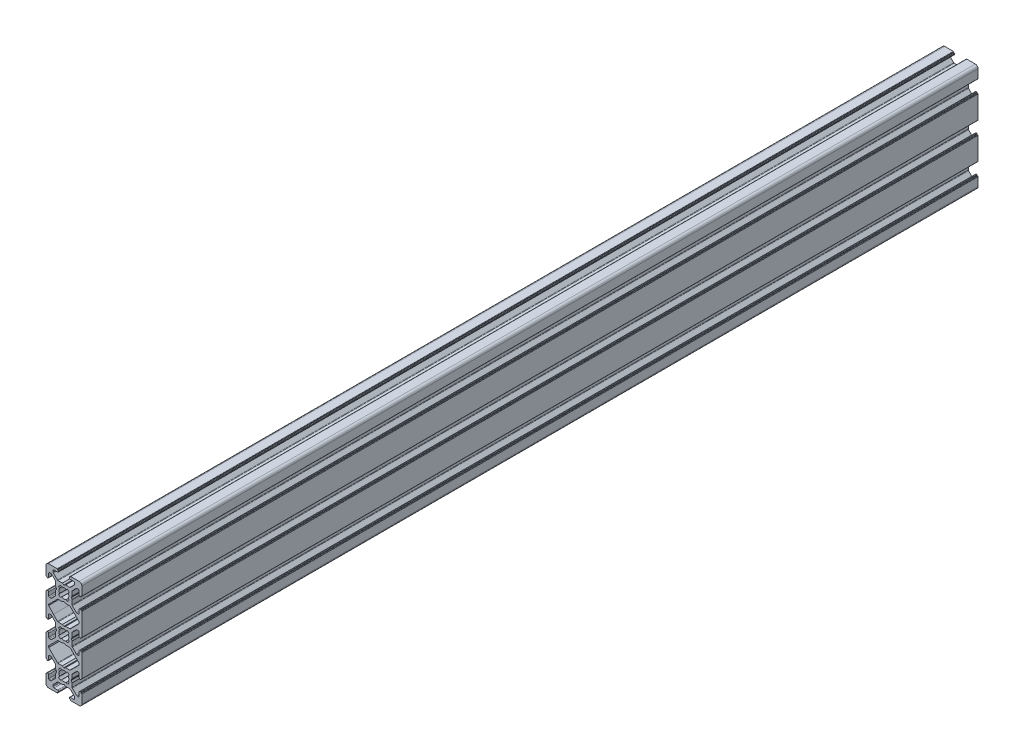
from build123d import *

# Parameters (mm, degrees)
EXTRUDE1_DEPTH = 500


with BuildPart() as part:
    # Sketch2 → Extrude1 (new body)
    with BuildSketch(Plane.XY):
        with BuildLine():
            Line((8.499999987, 16.455782504), (8.499999987, 14.505782744))
            ThreePointArc((8.499999987, 14.505782744), (8.353553378, 14.152229354), (7.999999987, 14.005782744))
            Line((7.999999987, 14.005782744), (7.267767007, 14.005782744))
            ThreePointArc((7.267767007, 14.005782744), (7.076425291, 14.043842978), (6.914213616, 14.152229354))
            Line((6.914213616, 14.152229354), (4.721446323, 16.344996647))
            ThreePointArc((4.721446323, 16.344996647), (4.613059947, 16.507208322), (4.574999713, 16.698550038))
            Line((4.574999713, 16.698550038), (4.574999713, 19.177192543))
            ThreePointArc((4.574999713, 19.177192543), (4.568184878, 19.228956354), (4.548204792, 19.277192547))
            Line((4.548204792, 19.277192547), (4.141986965, 19.980782422))
            ThreePointArc((4.141986965, 19.980782422), (4.115192043, 20.080782422), (4.14198696, 20.180782422))
            Line((4.14198696, 20.180782422), (4.548204796, 20.884372394))
            ThreePointArc((4.548204796, 20.884372394), (4.568184879, 20.932608583), (4.574999713, 20.98437239))
            Line((4.574999713, 20.98437239), (4.574999713, 23.313015505))
            ThreePointArc((4.574999713, 23.313015505), (4.613059942, 23.50435721), (4.721446305, 23.666568878))
            Line((4.721446305, 23.666568878), (6.914213331, 25.859336117))
            ThreePointArc((6.914213331, 25.859336117), (7.076425073, 25.967722531), (7.267766873, 26.005782744))
            Line((7.267766873, 26.005782744), (7.999999853, 26.005782744))
            ThreePointArc((7.999999853, 26.005782744), (8.353553338, 25.859336095), (8.499999987, 25.50578261))
            Line((8.499999987, 25.50578261), (8.499999987, 23.455782504))
            ThreePointArc((8.499999987, 23.455782504), (8.646446596, 23.102229113), (8.999999987, 22.955782504))
            Line((8.999999987, 22.955782504), (9.29999992, 22.955782504))
            ThreePointArc((9.29999992, 22.955782504), (9.441421276, 23.014361147), (9.49999992, 23.155782504))
            Line((9.49999992, 23.155782504), (9.49999992, 23.255782504))
            ThreePointArc((9.49999992, 23.255782504), (9.558578564, 23.39720386), (9.69999992, 23.455782504))
            Line((9.69999992, 23.455782504), (9.79999992, 23.455782504))
            ThreePointArc((9.79999992, 23.455782504), (9.941421276, 23.514361147), (9.99999992, 23.655782504))
            Line((9.99999992, 23.655782504), (9.99999992, 36.255782504))
            ThreePointArc((9.99999992, 36.255782504), (9.941421276, 36.39720386), (9.79999992, 36.455782504))
            Line((9.79999992, 36.455782504), (9.69999992, 36.455782504))
            ThreePointArc((9.69999992, 36.455782504), (9.558578564, 36.514361147), (9.49999992, 36.655782504))
            Line((9.49999992, 36.655782504), (9.49999992, 36.755782504))
            ThreePointArc((9.49999992, 36.755782504), (9.441421276, 36.89720386), (9.29999992, 36.955782504))
            Line((9.29999992, 36.955782504), (8.999999987, 36.955782504))
            ThreePointArc((8.999999987, 36.955782504), (8.646446596, 36.809335894), (8.499999987, 36.455782504))
            Line((8.499999987, 36.455782504), (8.499999987, 34.505782744))
            ThreePointArc((8.499999987, 34.505782744), (8.353553378, 34.152229354), (7.999999987, 34.005782744))
            Line((7.999999987, 34.005782744), (7.267767007, 34.005782744))
            ThreePointArc((7.267767007, 34.005782744), (7.076425291, 34.043842978), (6.914213616, 34.152229354))
            Line((6.914213616, 34.152229354), (4.721446323, 36.344996647))
            ThreePointArc((4.721446323, 36.344996647), (4.613059947, 36.507208322), (4.574999713, 36.698550038))
            Line((4.574999713, 36.698550038), (4.574999713, 39.177192543))
            ThreePointArc((4.574999713, 39.177192543), (4.568184878, 39.228956354), (4.548204792, 39.277192547))
            Line((4.548204792, 39.277192547), (4.141986965, 39.980782422))
            ThreePointArc((4.141986965, 39.980782422), (4.115192043, 40.080782422), (4.14198696, 40.180782422))
            Line((4.14198696, 40.180782422), (4.548204796, 40.884372394))
            ThreePointArc((4.548204796, 40.884372394), (4.568184879, 40.932608583), (4.574999713, 40.98437239))
            Line((4.574999713, 40.98437239), (4.574999713, 43.313015505))
            ThreePointArc((4.574999713, 43.313015505), (4.613059942, 43.50435721), (4.721446305, 43.666568878))
            Line((4.721446305, 43.666568878), (6.914213331, 45.859336117))
            ThreePointArc((6.914213331, 45.859336117), (7.076425073, 45.967722531), (7.267766873, 46.005782744))
            Line((7.267766873, 46.005782744), (7.999999853, 46.005782744))
            ThreePointArc((7.999999853, 46.005782744), (8.35355333, 45.859336182), (8.499999987, 45.505782744))
            Line((8.499999987, 45.505782744), (8.499999987, 43.455782504))
            ThreePointArc((8.499999987, 43.455782504), (8.646446596, 43.102229113), (8.999999987, 42.955782504))
            Line((8.999999987, 42.955782504), (9.29999992, 42.955782504))
            ThreePointArc((9.29999992, 42.955782504), (9.441421276, 43.014361147), (9.49999992, 43.155782504))
            Line((9.49999992, 43.155782504), (9.49999992, 43.255782504))
            ThreePointArc((9.49999992, 43.255782504), (9.558578564, 43.39720386), (9.69999992, 43.455782504))
            Line((9.69999992, 43.455782504), (9.79999992, 43.455782504))
            ThreePointArc((9.79999992, 43.455782504), (9.941421276, 43.514361147), (9.99999992, 43.655782504))
            Line((9.99999992, 43.655782504), (9.99999992, 48.49999967))
            ThreePointArc((9.99999992, 48.49999967), (9.560660092, 49.560659842), (8.49999992, 49.99999967))
            Line((8.49999992, 49.99999967), (3.74999992, 49.99999967))
            ThreePointArc((3.74999992, 49.99999967), (3.608578564, 49.941421026), (3.54999992, 49.79999967))
            Line((3.54999992, 49.79999967), (3.54999992, 49.69999967))
            ThreePointArc((3.54999992, 49.69999967), (3.491421276, 49.558578314), (3.34999992, 49.49999967))
            Line((3.34999992, 49.49999967), (3.2, 49.49999967))
            ThreePointArc((3.2, 49.49999967), (3.058578644, 49.441421026), (3, 49.29999967))
            Line((3, 49.29999967), (3, 48.99999967))
            ThreePointArc((3, 48.99999967), (3.146446609, 48.646446279), (3.5, 48.49999967))
            Line((3.5, 48.49999967), (5.5, 48.49999967))
            ThreePointArc((5.5, 48.49999967), (5.853553391, 48.353553061), (6, 47.99999967))
            Line((6, 47.99999967), (6, 47.267766556))
            ThreePointArc((6, 47.267766556), (5.961939766, 47.07642484), (5.853553391, 46.914213165))
            Line((5.853553391, 46.914213165), (3.585786528, 44.646446303))
            ThreePointArc((3.585786528, 44.646446303), (3.423574854, 44.538059927), (3.232233137, 44.499999693))
            Line((3.232233137, 44.499999693), (0.953589731, 44.499999693))
            ThreePointArc((0.953589731, 44.499999693), (0.901825919, 44.493184858), (0.853589726, 44.473204772))
            Line((0.853589726, 44.473204772), (0.059202761, 44.014565218))
            ThreePointArc((0.059202761, 44.014565218), (0, 43.998701885), (-0.059202761, 44.014565218))
            Line((-0.059202761, 44.014565218), (-0.853589726, 44.473204772))
            ThreePointArc((-0.853589726, 44.473204772), (-0.901825919, 44.493184858), (-0.953589731, 44.499999693))
            Line((-0.953589731, 44.499999693), (-3.232233137, 44.499999693))
            ThreePointArc((-3.232233137, 44.499999693), (-3.423574854, 44.538059927), (-3.585786528, 44.646446303))
            Line((-3.585786528, 44.646446303), (-5.853553391, 46.914213165))
            ThreePointArc((-5.853553391, 46.914213165), (-5.961939766, 47.07642484), (-6, 47.267766556))
            Line((-6, 47.267766556), (-6, 47.99999967))
            ThreePointArc((-6, 47.99999967), (-5.853553391, 48.353553061), (-5.5, 48.49999967))
            Line((-5.5, 48.49999967), (-3.5, 48.49999967))
            ThreePointArc((-3.5, 48.49999967), (-3.146446609, 48.646446279), (-3, 48.99999967))
            Line((-3, 48.99999967), (-3, 49.29999967))
            ThreePointArc((-3, 49.29999967), (-3.058578644, 49.441421026), (-3.2, 49.49999967))
            Line((-3.2, 49.49999967), (-3.34999992, 49.49999967))
            ThreePointArc((-3.34999992, 49.49999967), (-3.491421276, 49.558578314), (-3.54999992, 49.69999967))
            Line((-3.54999992, 49.69999967), (-3.54999992, 49.79999967))
            ThreePointArc((-3.54999992, 49.79999967), (-3.608578564, 49.941421026), (-3.74999992, 49.99999967))
            Line((-3.74999992, 49.99999967), (-8.49999992, 49.99999967))
            ThreePointArc((-8.49999992, 49.99999967), (-9.560660092, 49.560659842), (-9.99999992, 48.49999967))
            Line((-9.99999992, 48.49999967), (-9.99999992, 43.655782504))
            ThreePointArc((-9.99999992, 43.655782504), (-9.941421276, 43.514361147), (-9.79999992, 43.455782504))
            Line((-9.79999992, 43.455782504), (-9.69999992, 43.455782504))
            ThreePointArc((-9.69999992, 43.455782504), (-9.558578564, 43.39720386), (-9.49999992, 43.255782504))
            Line((-9.49999992, 43.255782504), (-9.49999992, 43.155782504))
            ThreePointArc((-9.49999992, 43.155782504), (-9.441421276, 43.014361147), (-9.29999992, 42.955782504))
            Line((-9.29999992, 42.955782504), (-8.999999987, 42.955782504))
            ThreePointArc((-8.999999987, 42.955782504), (-8.646446596, 43.102229113), (-8.499999987, 43.455782504))
            Line((-8.499999987, 43.455782504), (-8.499999987, 45.50578261))
            ThreePointArc((-8.499999987, 45.50578261), (-8.353553338, 45.859336095), (-7.999999853, 46.005782744))
            Line((-7.999999853, 46.005782744), (-7.267766739, 46.005782744))
            ThreePointArc((-7.267766739, 46.005782744), (-7.076425012, 45.967722506), (-6.914213331, 45.859336117))
            Line((-6.914213331, 45.859336117), (-4.721446305, 43.666568878))
            ThreePointArc((-4.721446305, 43.666568878), (-4.613059942, 43.50435721), (-4.574999713, 43.313015505))
            Line((-4.574999713, 43.313015505), (-4.574999713, 40.98437239))
            ThreePointArc((-4.574999713, 40.98437239), (-4.568184879, 40.932608583), (-4.548204796, 40.884372394))
            Line((-4.548204796, 40.884372394), (-4.14198696, 40.180782422))
            ThreePointArc((-4.14198696, 40.180782422), (-4.115192043, 40.080782422), (-4.141986965, 39.980782422))
            Line((-4.141986965, 39.980782422), (-4.548204792, 39.277192547))
            ThreePointArc((-4.548204792, 39.277192547), (-4.568184878, 39.228956354), (-4.574999713, 39.177192543))
            Line((-4.574999713, 39.177192543), (-4.574999713, 36.698550038))
            ThreePointArc((-4.574999713, 36.698550038), (-4.613059947, 36.507208322), (-4.721446323, 36.344996647))
            Line((-4.721446323, 36.344996647), (-6.914213616, 34.152229354))
            ThreePointArc((-6.914213616, 34.152229354), (-7.076425291, 34.043842978), (-7.267767007, 34.005782744))
            Line((-7.267767007, 34.005782744), (-7.999999987, 34.005782744))
            ThreePointArc((-7.999999987, 34.005782744), (-8.353553378, 34.152229354), (-8.499999987, 34.505782744))
            Line((-8.499999987, 34.505782744), (-8.499999987, 36.455782504))
            ThreePointArc((-8.499999987, 36.455782504), (-8.646446596, 36.809335894), (-8.999999987, 36.955782504))
            Line((-8.999999987, 36.955782504), (-9.29999992, 36.955782504))
            ThreePointArc((-9.29999992, 36.955782504), (-9.441421276, 36.89720386), (-9.49999992, 36.755782504))
            Line((-9.49999992, 36.755782504), (-9.49999992, 36.655782504))
            ThreePointArc((-9.49999992, 36.655782504), (-9.558578564, 36.514361147), (-9.69999992, 36.455782504))
            Line((-9.69999992, 36.455782504), (-9.79999992, 36.455782504))
            ThreePointArc((-9.79999992, 36.455782504), (-9.941421276, 36.39720386), (-9.99999992, 36.255782504))
            Line((-9.99999992, 36.255782504), (-9.99999992, 23.655782504))
            ThreePointArc((-9.99999992, 23.655782504), (-9.941421276, 23.514361147), (-9.79999992, 23.455782504))
            Line((-9.79999992, 23.455782504), (-9.69999992, 23.455782504))
            ThreePointArc((-9.69999992, 23.455782504), (-9.558578564, 23.39720386), (-9.49999992, 23.255782504))
            Line((-9.49999992, 23.255782504), (-9.49999992, 23.155782504))
            ThreePointArc((-9.49999992, 23.155782504), (-9.441421276, 23.014361147), (-9.29999992, 22.955782504))
            Line((-9.29999992, 22.955782504), (-8.999999987, 22.955782504))
            ThreePointArc((-8.999999987, 22.955782504), (-8.646446596, 23.102229113), (-8.499999987, 23.455782504))
            Line((-8.499999987, 23.455782504), (-8.499999987, 25.50578261))
            ThreePointArc((-8.499999987, 25.50578261), (-8.353553338, 25.859336095), (-7.999999853, 26.005782744))
            Line((-7.999999853, 26.005782744), (-7.267766873, 26.005782744))
            ThreePointArc((-7.267766873, 26.005782744), (-7.076425073, 25.967722531), (-6.914213331, 25.859336117))
            Line((-6.914213331, 25.859336117), (-4.721446305, 23.666568878))
            ThreePointArc((-4.721446305, 23.666568878), (-4.613059942, 23.50435721), (-4.574999713, 23.313015505))
            Line((-4.574999713, 23.313015505), (-4.574999713, 20.98437239))
            ThreePointArc((-4.574999713, 20.98437239), (-4.568184879, 20.932608583), (-4.548204796, 20.884372394))
            Line((-4.548204796, 20.884372394), (-4.14198696, 20.180782422))
            ThreePointArc((-4.14198696, 20.180782422), (-4.115192043, 20.080782422), (-4.141986965, 19.980782422))
            Line((-4.141986965, 19.980782422), (-4.548204792, 19.277192547))
            ThreePointArc((-4.548204792, 19.277192547), (-4.568184878, 19.228956354), (-4.574999713, 19.177192543))
            Line((-4.574999713, 19.177192543), (-4.574999713, 16.698550038))
            ThreePointArc((-4.574999713, 16.698550038), (-4.613059947, 16.507208322), (-4.721446323, 16.344996647))
            Line((-4.721446323, 16.344996647), (-6.914213616, 14.152229354))
            ThreePointArc((-6.914213616, 14.152229354), (-7.076425291, 14.043842978), (-7.267767007, 14.005782744))
            Line((-7.267767007, 14.005782744), (-7.999999987, 14.005782744))
            ThreePointArc((-7.999999987, 14.005782744), (-8.353553378, 14.152229354), (-8.499999987, 14.505782744))
            Line((-8.499999987, 14.505782744), (-8.499999987, 16.455782504))
            ThreePointArc((-8.499999987, 16.455782504), (-8.646446596, 16.809335894), (-8.999999987, 16.955782504))
            Line((-8.999999987, 16.955782504), (-9.29999992, 16.955782504))
            ThreePointArc((-9.29999992, 16.955782504), (-9.441421276, 16.89720386), (-9.49999992, 16.755782504))
            Line((-9.49999992, 16.755782504), (-9.49999992, 16.655782504))
            ThreePointArc((-9.49999992, 16.655782504), (-9.558578564, 16.514361147), (-9.69999992, 16.455782504))
            Line((-9.69999992, 16.455782504), (-9.79999992, 16.455782504))
            ThreePointArc((-9.79999992, 16.455782504), (-9.941421276, 16.39720386), (-9.99999992, 16.255782504))
            Line((-9.99999992, 16.255782504), (-9.99999992, 3.75))
            ThreePointArc((-9.99999992, 3.75), (-9.941421276, 3.608578644), (-9.79999992, 3.55))
            Line((-9.79999992, 3.55), (-9.69999992, 3.55))
            ThreePointArc((-9.69999992, 3.55), (-9.558578564, 3.491421356), (-9.49999992, 3.35))
            Line((-9.49999992, 3.35), (-9.49999992, 3.2))
            ThreePointArc((-9.49999992, 3.2), (-9.441421276, 3.058578644), (-9.29999992, 3))
            Line((-9.29999992, 3), (-8.99999992, 3))
            ThreePointArc((-8.99999992, 3), (-8.646446529, 3.146446609), (-8.49999992, 3.5))
            Line((-8.49999992, 3.5), (-8.49999992, 5.5))
            ThreePointArc((-8.49999992, 5.5), (-8.353553311, 5.853553391), (-7.99999992, 6))
            Line((-7.99999992, 6), (-7.467766346, 6))
            ThreePointArc((-7.467766346, 6), (-7.27642463, 5.961939766), (-7.114212955, 5.853553391))
            Line((-7.114212955, 5.853553391), (-4.721446323, 3.460786758))
            ThreePointArc((-4.721446323, 3.460786758), (-4.613059947, 3.298575084), (-4.574999713, 3.107233367))
            Line((-4.574999713, 3.107233367), (-4.574999713, 1.083493192))
            ThreePointArc((-4.574999713, 1.083493192), (-4.568184878, 1.031729383), (-4.548204794, 0.983493192))
            Line((-4.548204794, 0.983493192), (-4.038119761, 0.1))
            ThreePointArc((-4.038119761, 0.1), (-4.011324842, 0), (-4.038119761, -0.1))
            Line((-4.038119761, -0.1), (-4.548204794, -0.983493192))
            ThreePointArc((-4.548204794, -0.983493192), (-4.568184878, -1.031729383), (-4.574999713, -1.083493192))
            Line((-4.574999713, -1.083493192), (-4.574999713, -3.107233367))
            ThreePointArc((-4.574999713, -3.107233367), (-4.613059947, -3.298575084), (-4.721446323, -3.460786758))
            Line((-4.721446323, -3.460786758), (-7.114212955, -5.853553391))
            ThreePointArc((-7.114212955, -5.853553391), (-7.27642463, -5.961939766), (-7.467766346, -6))
            Line((-7.467766346, -6), (-7.99999992, -6))
            ThreePointArc((-7.99999992, -6), (-8.353553311, -5.853553391), (-8.49999992, -5.5))
            Line((-8.49999992, -5.5), (-8.49999992, -3.5))
            ThreePointArc((-8.49999992, -3.5), (-8.646446529, -3.146446609), (-8.99999992, -3))
            Line((-8.99999992, -3), (-9.29999992, -3))
            ThreePointArc((-9.29999992, -3), (-9.441421276, -3.058578644), (-9.49999992, -3.2))
            Line((-9.49999992, -3.2), (-9.49999992, -3.35))
            ThreePointArc((-9.49999992, -3.35), (-9.558578564, -3.491421356), (-9.69999992, -3.55))
            Line((-9.69999992, -3.55), (-9.79999992, -3.55))
            ThreePointArc((-9.79999992, -3.55), (-9.941421276, -3.608578644), (-9.99999992, -3.75))
            Line((-9.99999992, -3.75), (-9.99999992, -8.5))
            ThreePointArc((-9.99999992, -8.5), (-9.560660092, -9.560660172), (-8.49999992, -10))
            Line((-8.49999992, -10), (-3.74999992, -10))
            ThreePointArc((-3.74999992, -10), (-3.608578564, -9.941421356), (-3.54999992, -9.8))
            Line((-3.54999992, -9.8), (-3.54999992, -9.7))
            ThreePointArc((-3.54999992, -9.7), (-3.491421276, -9.558578644), (-3.34999992, -9.5))
            Line((-3.34999992, -9.5), (-3.2, -9.5))
            ThreePointArc((-3.2, -9.5), (-3.058578644, -9.441421356), (-3, -9.3))
            Line((-3, -9.3), (-3, -9))
            ThreePointArc((-3, -9), (-3.146446609, -8.646446609), (-3.5, -8.5))
            Line((-3.5, -8.5), (-5.5, -8.5))
            ThreePointArc((-5.5, -8.5), (-5.853553391, -8.353553391), (-6, -8))
            Line((-6, -8), (-6, -7.267766929))
            ThreePointArc((-6, -7.267766929), (-5.961939766, -7.076425212), (-5.853553391, -6.914213538))
            Line((-5.853553391, -6.914213538), (-3.585786494, -4.646446642))
            ThreePointArc((-3.585786494, -4.646446642), (-3.42357482, -4.538060266), (-3.232233104, -4.500000032))
            Line((-3.232233104, -4.500000032), (-0.953589838, -4.500000032))
            ThreePointArc((-0.953589838, -4.500000032), (-0.901826029, -4.493185198), (-0.853589838, -4.473205113))
            Line((-0.853589838, -4.473205113), (-0.1, -4.038119817))
            ThreePointArc((-0.1, -4.038119817), (0, -4.011324898), (0.1, -4.038119817))
            Line((0.1, -4.038119817), (0.853589838, -4.473205113))
            ThreePointArc((0.853589838, -4.473205113), (0.901826029, -4.493185198), (0.953589838, -4.500000032))
            Line((0.953589838, -4.500000032), (3.232233104, -4.500000032))
            ThreePointArc((3.232233104, -4.500000032), (3.42357482, -4.538060266), (3.585786494, -4.646446642))
            Line((3.585786494, -4.646446642), (5.853553391, -6.914213538))
            ThreePointArc((5.853553391, -6.914213538), (5.961939766, -7.076425212), (6, -7.267766929))
            Line((6, -7.267766929), (6, -8))
            ThreePointArc((6, -8), (5.853553391, -8.353553391), (5.5, -8.5))
            Line((5.5, -8.5), (3.5, -8.5))
            ThreePointArc((3.5, -8.5), (3.146446609, -8.646446609), (3, -9))
            Line((3, -9), (3, -9.3))
            ThreePointArc((3, -9.3), (3.058578644, -9.441421356), (3.2, -9.5))
            Line((3.2, -9.5), (3.34999992, -9.5))
            ThreePointArc((3.34999992, -9.5), (3.491421276, -9.558578644), (3.54999992, -9.7))
            Line((3.54999992, -9.7), (3.54999992, -9.8))
            ThreePointArc((3.54999992, -9.8), (3.608578564, -9.941421356), (3.74999992, -10))
            Line((3.74999992, -10), (8.49999992, -10))
            ThreePointArc((8.49999992, -10), (9.560660092, -9.560660172), (9.99999992, -8.5))
            Line((9.99999992, -8.5), (9.99999992, -3.7))
            ThreePointArc((9.99999992, -3.7), (9.941421276, -3.558578644), (9.79999992, -3.5))
            Line((9.79999992, -3.5), (9.69999992, -3.5))
            ThreePointArc((9.69999992, -3.5), (9.558578564, -3.441421356), (9.49999992, -3.3))
            Line((9.49999992, -3.3), (9.49999992, -3.2))
            ThreePointArc((9.49999992, -3.2), (9.441421276, -3.058578644), (9.29999992, -3))
            Line((9.29999992, -3), (8.99999992, -3))
            ThreePointArc((8.99999992, -3), (8.646446529, -3.146446609), (8.49999992, -3.5))
            Line((8.49999992, -3.5), (8.49999992, -5.499999866))
            ThreePointArc((8.49999992, -5.499999866), (8.353553271, -5.853553351), (7.999999786, -6))
            Line((7.999999786, -6), (7.467766346, -6))
            ThreePointArc((7.467766346, -6), (7.27642463, -5.961939766), (7.114212955, -5.853553391))
            Line((7.114212955, -5.853553391), (4.721446323, -3.460786758))
            ThreePointArc((4.721446323, -3.460786758), (4.613059947, -3.298575084), (4.574999713, -3.107233367))
            Line((4.574999713, -3.107233367), (4.574999713, -1.083493446))
            ThreePointArc((4.574999713, -1.083493446), (4.568184878, -1.031729637), (4.548204794, -0.983493446))
            Line((4.548204794, -0.983493446), (4.038119615, -0.1))
            ThreePointArc((4.038119615, -0.1), (4.011324696, 0), (4.038119615, 0.1))
            Line((4.038119615, 0.1), (4.548204794, 0.983493446))
            ThreePointArc((4.548204794, 0.983493446), (4.568184878, 1.031729637), (4.574999713, 1.083493446))
            Line((4.574999713, 1.083493446), (4.574999713, 3.107233367))
            ThreePointArc((4.574999713, 3.107233367), (4.613059947, 3.298575084), (4.721446323, 3.460786758))
            Line((4.721446323, 3.460786758), (7.114212955, 5.853553391))
            ThreePointArc((7.114212955, 5.853553391), (7.27642463, 5.961939766), (7.467766346, 6))
            Line((7.467766346, 6), (7.999999786, 6))
            ThreePointArc((7.999999786, 6), (8.353553177, 5.853553391), (8.499999786, 5.5))
            Line((8.499999786, 5.5), (8.499999786, 3.5))
            ThreePointArc((8.499999786, 3.5), (8.646446395, 3.146446609), (8.999999786, 3))
            Line((8.999999786, 3), (9.299999961, 3))
            ThreePointArc((9.299999961, 3), (9.441421317, 3.058578644), (9.499999961, 3.2))
            Line((9.499999961, 3.2), (9.499999961, 3.3))
            ThreePointArc((9.499999961, 3.3), (9.558578605, 3.441421356), (9.699999961, 3.5))
            Line((9.699999961, 3.5), (9.79999992, 3.5))
            ThreePointArc((9.79999992, 3.5), (9.941421276, 3.558578644), (9.99999992, 3.7))
            Line((9.99999992, 3.7), (9.99999992, 16.255782504))
            ThreePointArc((9.99999992, 16.255782504), (9.941421276, 16.39720386), (9.79999992, 16.455782504))
            Line((9.79999992, 16.455782504), (9.69999992, 16.455782504))
            ThreePointArc((9.69999992, 16.455782504), (9.558578564, 16.514361147), (9.49999992, 16.655782504))
            Line((9.49999992, 16.655782504), (9.49999992, 16.755782504))
            ThreePointArc((9.49999992, 16.755782504), (9.441421276, 16.89720386), (9.29999992, 16.955782504))
            Line((9.29999992, 16.955782504), (8.999999987, 16.955782504))
            ThreePointArc((8.999999987, 16.955782504), (8.646446596, 16.809335894), (8.499999987, 16.455782504))
        make_face()
        with BuildLine():
            Line((-8.499999987, 30.445123452), (-8.499999987, 29.884028549))
            Line((-8.499999987, 29.884028549), (-5.853553391, 26.914213165))
            Line((-5.853553391, 26.914213165), (-3.585786528, 24.646446303))
            ThreePointArc((-3.585786528, 24.646446303), (-3.423574854, 24.538059927), (-3.232233137, 24.499999693))
            Line((-3.232233137, 24.499999693), (-0.953589731, 24.499999693))
            ThreePointArc((-0.953589731, 24.499999693), (-0.901825919, 24.493184858), (-0.853589726, 24.473204772))
            Line((-0.853589726, 24.473204772), (-0.059202761, 24.014565218))
            ThreePointArc((-0.059202761, 24.014565218), (0, 23.998701885), (0.059202761, 24.014565218))
            Line((0.059202761, 24.014565218), (0.853589726, 24.473204772))
            ThreePointArc((0.853589726, 24.473204772), (0.901825919, 24.493184858), (0.953589731, 24.499999693))
            Line((0.953589731, 24.499999693), (3.232233137, 24.499999693))
            ThreePointArc((3.232233137, 24.499999693), (3.423574854, 24.538059927), (3.585786528, 24.646446303))
            Line((3.585786528, 24.646446303), (5.853553391, 26.914213165))
            Line((5.853553391, 26.914213165), (8.499999987, 29.560659762))
            Line((8.499999987, 29.560659762), (8.499999987, 30.445123452))
            Line((8.499999987, 30.445123452), (3.585786708, 35.359336253))
            ThreePointArc((3.585786708, 35.359336253), (3.423575039, 35.467722616), (3.232233334, 35.505782845))
            Line((3.232233334, 35.505782845), (0.953589908, 35.505782845))
            ThreePointArc((0.953589908, 35.505782845), (0.901826101, 35.512597679), (0.853589912, 35.532577762))
            Line((0.853589912, 35.532577762), (0.100000013, 35.967663068))
            ThreePointArc((0.100000013, 35.967663068), (0, 35.99445799), (-0.100000013, 35.967663068))
            Line((-0.100000013, 35.967663068), (-0.853589912, 35.532577762))
            ThreePointArc((-0.853589912, 35.532577762), (-0.901826101, 35.512597679), (-0.953589908, 35.505782845))
            Line((-0.953589908, 35.505782845), (-3.232233334, 35.505782845))
            ThreePointArc((-3.232233334, 35.505782845), (-3.423575039, 35.467722616), (-3.585786708, 35.359336253))
            Line((-3.585786708, 35.359336253), (-8.499999987, 30.445123452))
        make_face(mode=Mode.SUBTRACT)
        with BuildLine():
            Line((-3.585786481, 4.646446666), (-8.499999987, 9.560660172))
            Line((-8.499999987, 9.560660172), (-8.499999987, 10.445123452))
            Line((-8.499999987, 10.445123452), (-3.585786708, 15.359336253))
            ThreePointArc((-3.585786708, 15.359336253), (-3.423575039, 15.467722616), (-3.232233334, 15.505782845))
            Line((-3.232233334, 15.505782845), (-0.953589908, 15.505782845))
            ThreePointArc((-0.953589908, 15.505782845), (-0.901826101, 15.512597679), (-0.853589912, 15.532577762))
            Line((-0.853589912, 15.532577762), (-0.100000013, 15.967663068))
            ThreePointArc((-0.100000013, 15.967663068), (0, 15.99445799), (0.100000013, 15.967663068))
            Line((0.100000013, 15.967663068), (0.853589912, 15.532577762))
            ThreePointArc((0.853589912, 15.532577762), (0.901826101, 15.512597679), (0.953589908, 15.505782845))
            Line((0.953589908, 15.505782845), (3.232233334, 15.505782845))
            ThreePointArc((3.232233334, 15.505782845), (3.423575039, 15.467722616), (3.585786708, 15.359336253))
            Line((3.585786708, 15.359336253), (8.499999987, 10.445123452))
            Line((8.499999987, 10.445123452), (8.499999987, 9.560660172))
            Line((8.499999987, 9.560660172), (3.585786481, 4.646446666))
            ThreePointArc((3.585786481, 4.646446666), (3.423574807, 4.538060291), (3.232233091, 4.500000057))
            Line((3.232233091, 4.500000057), (0.953589684, 4.500000057))
            ThreePointArc((0.953589684, 4.500000057), (0.901825873, 4.493185221), (0.85358968, 4.473205135))
            Line((0.85358968, 4.473205135), (0.100000004, 4.038119909))
            ThreePointArc((0.100000004, 4.038119909), (8.8e-08, 4.011324987), (-0.099999852, 4.038119821))
            Line((-0.099999852, 4.038119821), (-0.85358968, 4.473205135))
            ThreePointArc((-0.85358968, 4.473205135), (-0.901825873, 4.493185221), (-0.953589684, 4.500000057))
            Line((-0.953589684, 4.500000057), (-3.232233091, 4.500000057))
            ThreePointArc((-3.232233091, 4.500000057), (-3.423574807, 4.538060291), (-3.585786481, 4.646446666))
        make_face(mode=Mode.SUBTRACT)
        with BuildLine():
            Line((1.258185436, 2.445295362), (1.909931107, 2.99217486))
            ThreePointArc((1.909931107, 2.99217486), (2.508410608, 2.511737138), (2.989641056, 1.913894874))
            Line((2.989641056, 1.913894874), (2.445295423, 1.258185317))
            ThreePointArc((2.445295423, 1.258185317), (2.75, -6.7e-08), (2.445295362, -1.258185436))
            Line((2.445295362, -1.258185436), (2.99217486, -1.909931107))
            ThreePointArc((2.99217486, -1.909931107), (2.511722921, -2.508424844), (1.913860983, -2.989662751))
            Line((1.913860983, -2.989662751), (1.262349172, -2.443148495))
            ThreePointArc((1.262349172, -2.443148495), (0.002342314, -2.749999002), (-1.258185436, -2.445295362))
            Line((-1.258185436, -2.445295362), (-1.909931107, -2.99217486))
            ThreePointArc((-1.909931107, -2.99217486), (-2.508424844, -2.511722921), (-2.989662751, -1.913860983))
            Line((-2.989662751, -1.913860983), (-2.443148495, -1.262349172))
            ThreePointArc((-2.443148495, -1.262349172), (-2.749999002, -0.002342314), (-2.445295362, 1.258185436))
            Line((-2.445295362, 1.258185436), (-2.99217486, 1.909931107))
            ThreePointArc((-2.99217486, 1.909931107), (-2.511737138, 2.508410608), (-1.913894874, 2.989641056))
            Line((-1.913894874, 2.989641056), (-1.262349172, 2.443148495))
            ThreePointArc((-1.262349172, 2.443148495), (-0.002342314, 2.749999002), (1.258185436, 2.445295362))
        make_face(mode=Mode.SUBTRACT)
        with BuildLine():
            Line((1.258185317, 37.560487321), (1.887054865, 37.058067708))
            ThreePointArc((1.887054865, 37.058067708), (2.474873674, 37.53090895), (2.947714945, 38.118727736))
            Line((2.947714945, 38.118727736), (2.445295362, 38.747597308))
            ThreePointArc((2.445295362, 38.747597308), (2.75, 40.005782677), (2.445295423, 41.263968061))
            Line((2.445295423, 41.263968061), (2.947715037, 41.892837609))
            ThreePointArc((2.947715037, 41.892837609), (2.474873794, 42.480656418), (1.887055008, 42.953497689))
            Line((1.887055008, 42.953497689), (1.258185436, 42.451078106))
            ThreePointArc((1.258185436, 42.451078106), (6.7e-08, 42.755782744), (-1.258185317, 42.451078168))
            Line((-1.258185317, 42.451078168), (-1.887054865, 42.953497781))
            ThreePointArc((-1.887054865, 42.953497781), (-2.474873674, 42.480656539), (-2.947714945, 41.892837753))
            Line((-2.947714945, 41.892837753), (-2.445295362, 41.26396818))
            ThreePointArc((-2.445295362, 41.26396818), (-2.75, 40.005782811), (-2.445295423, 38.747597427))
            Line((-2.445295423, 38.747597427), (-2.947715037, 38.118727879))
            ThreePointArc((-2.947715037, 38.118727879), (-2.474873794, 37.53090907), (-1.887055008, 37.058067799))
            Line((-1.887055008, 37.058067799), (-1.258185436, 37.560487382))
            ThreePointArc((-1.258185436, 37.560487382), (-6.7e-08, 37.255782744), (1.258185317, 37.560487321))
        make_face(mode=Mode.SUBTRACT)
        with BuildLine():
            Line((1.258185317, 17.560487321), (1.887054865, 17.058067708))
            ThreePointArc((1.887054865, 17.058067708), (2.474873674, 17.53090895), (2.947714945, 18.118727736))
            Line((2.947714945, 18.118727736), (2.445295362, 18.747597308))
            ThreePointArc((2.445295362, 18.747597308), (2.75, 20.005782677), (2.445295423, 21.263968061))
            Line((2.445295423, 21.263968061), (2.947715037, 21.892837609))
            ThreePointArc((2.947715037, 21.892837609), (2.474873794, 22.480656418), (1.887055008, 22.953497689))
            Line((1.887055008, 22.953497689), (1.258185436, 22.451078106))
            ThreePointArc((1.258185436, 22.451078106), (6.7e-08, 22.755782744), (-1.258185317, 22.451078168))
            Line((-1.258185317, 22.451078168), (-1.887054865, 22.953497781))
            ThreePointArc((-1.887054865, 22.953497781), (-2.474873674, 22.480656539), (-2.947714945, 21.892837753))
            Line((-2.947714945, 21.892837753), (-2.445295362, 21.26396818))
            ThreePointArc((-2.445295362, 21.26396818), (-2.75, 20.005782811), (-2.445295423, 18.747597427))
            Line((-2.445295423, 18.747597427), (-2.947715037, 18.118727879))
            ThreePointArc((-2.947715037, 18.118727879), (-2.474873794, 17.53090907), (-1.887055008, 17.058067799))
            Line((-1.887055008, 17.058067799), (-1.258185436, 17.560487382))
            ThreePointArc((-1.258185436, 17.560487382), (-6.7e-08, 17.255782744), (1.258185317, 17.560487321))
        make_face(mode=Mode.SUBTRACT)
    extrude(amount=EXTRUDE1_DEPTH)


solid = part.part
